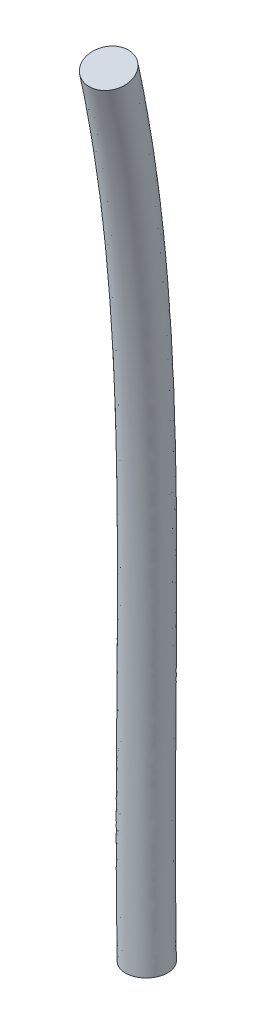
from build123d import *

# Parameters (mm, degrees)
SWEEP1_PROFILE_R = 3.175


with BuildPart() as part:
    # Sweep1: sweep along a curve in space
    with BuildLine() as sweep1_path:
        add(Edge.make_bspline(
            [(-22.9865, -45.773106351, 238.2462), (-25.357861953, -86.579056603, 227.426260702), (-27.70950127, -128.141073063, 228.609895105), (-26.897910645, -169.599986498, 228.5635)],
            knots=[0, 0, 0, 0, 1, 1, 1, 1], degree=3))
    # Sweep1 profile (on start of the path) → Sweep1 (sweep)
    with BuildSketch(Plane(origin=(-22.9865, -45.773106351, 238.2462), x_dir=(0, 0.25629905878088816, -0.9665975338619641), z_dir=(-0.05608360857878458, -0.965076182617274, -0.25589566349129816))):
        Circle(SWEEP1_PROFILE_R)
    sweep(path=sweep1_path.line)


solid = part.part
